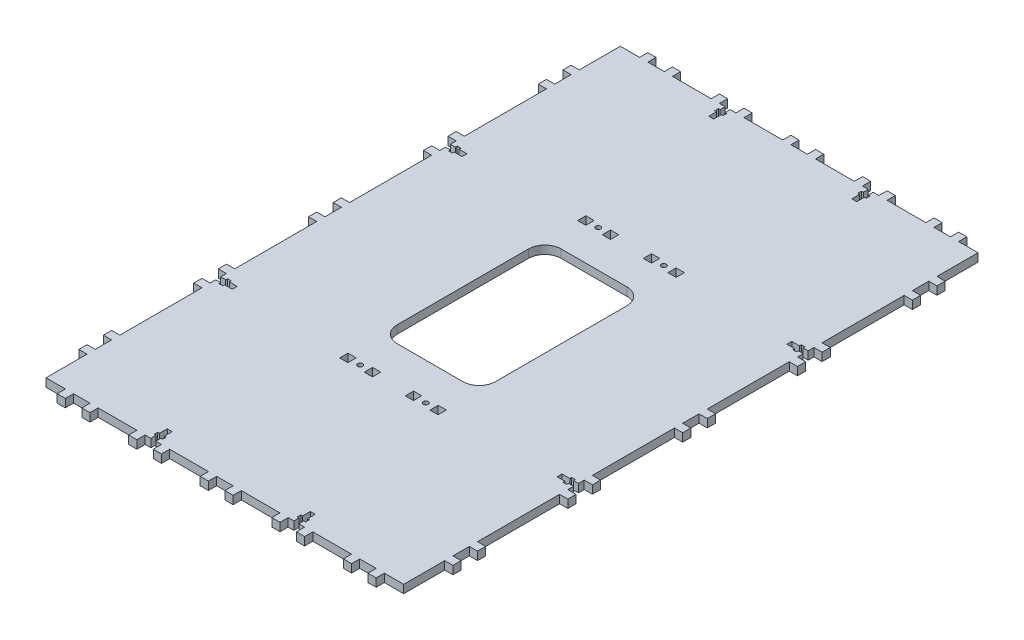
from build123d import *

# Parameters (mm, degrees)
SKETCH1_W           = 5
SKETCH1_H           = 5.05
SKETCH1_R           = 1.5
BOSS_EXTRUDE1_DEPTH = 5


with BuildPart() as part:
    # Sketch1 → Boss-Extrude1 (new body)
    with BuildSketch(Plane(origin=(0, 0, 0), x_dir=(1, 0, 0), z_dir=(0, 1, 0))):
        Polygon((97.2, -175), (109, -175), (109, -150), (114, -150), (114, -145), (109, -145), (109, -135), (114, -135), (114, -130), (109, -130), (109, -80), (114, -80), (114, -75), (109, -75), (109, -71.5), (106, -71.5), (106, -72.6), (103.7, -72.6), (103.7, -71.5), (99, -71.5), (99, -68.5), (103.7, -68.5), (103.7, -67.4), (106, -67.4), (106, -68.5), (109, -68.5), (109, -65), (114, -65), (114, -60), (109, -60), (109, -10), (114, -10), (114, -5), (109, -5), (109, 5), (114, 5), (114, 10), (109, 10), (109, 60), (114, 60), (114, 65), (109, 65), (109, 68.5), (106, 68.5), (106, 67.4), (103.7, 67.4), (103.7, 68.5), (99, 68.5), (99, 71.5), (103.7, 71.5), (103.7, 72.6), (106, 72.6), (106, 71.5), (109, 71.5), (109, 75), (114, 75), (114, 80), (109, 80), (109, 130), (114, 130), (114, 135), (109, 135), (109, 145), (114, 145), (114, 150), (109, 150), (109, 175), (97.2, 175), (97.2, 180), (92.2, 180), (92.2, 175), (82.2, 175), (82.2, 180), (77.2, 180), (77.2, 175), (53.6, 175), (53.6, 180), (48.6, 180), (48.6, 175), (45.1, 175), (45.1, 172), (46.2, 172), (46.2, 169.7), (45.1, 169.7), (45.1, 165), (42.1, 165), (42.1, 169.7), (41, 169.7), (41, 172), (42.1, 172), (42.1, 175), (38.6, 175), (38.6, 180), (33.6, 180), (33.6, 175), (19.5, 175), (10, 175), (10, 180), (5, 180), (5, 175), (-5, 175), (-5, 180), (-10, 180), (-10, 175), (-19.5, 175), (-33.6, 175), (-33.6, 180), (-38.6, 180), (-38.6, 175), (-42.1, 175), (-42.1, 172), (-41, 172), (-41, 169.7), (-42.1, 169.7), (-42.1, 165), (-45.1, 165), (-45.1, 169.7), (-46.2, 169.7), (-46.2, 172), (-45.1, 172), (-45.1, 175), (-48.6, 175), (-48.6, 180), (-53.6, 180), (-53.6, 175), (-77.2, 175), (-77.2, 180), (-82.2, 180), (-82.2, 175), (-92.2, 175), (-92.2, 180), (-97.2, 180), (-97.2, 175), (-109, 175), (-109, 150), (-114, 150), (-114, 145), (-109, 145), (-109, 135), (-114, 135), (-114, 130), (-109, 130), (-109, 80), (-114, 80), (-114, 75), (-109, 75), (-109, 71.5), (-106, 71.5), (-106, 72.6), (-103.7, 72.6), (-103.7, 71.5), (-99, 71.5), (-99, 68.5), (-103.7, 68.5), (-103.7, 67.4), (-106, 67.4), (-106, 68.5), (-109, 68.5), (-109, 65), (-114, 65), (-114, 60), (-109, 60), (-109, 10), (-114, 10), (-114, 5), (-109, 5), (-109, -5), (-114, -5), (-114, -10), (-109, -10), (-109, -60), (-114, -60), (-114, -65), (-109, -65), (-109, -68.5), (-106, -68.5), (-106, -67.4), (-103.7, -67.4), (-103.7, -68.5), (-99, -68.5), (-99, -71.5), (-103.7, -71.5), (-103.7, -72.6), (-106, -72.6), (-106, -71.5), (-109, -71.5), (-109, -75), (-114, -75), (-114, -80), (-109, -80), (-109, -130), (-114, -130), (-114, -135), (-109, -135), (-109, -145), (-114, -145), (-114, -150), (-109, -150), (-109, -175), (-97.2, -175), (-97.2, -180), (-92.2, -180), (-92.2, -175), (-82.2, -175), (-82.2, -180), (-77.2, -180), (-77.2, -175), (-53.6, -175), (-53.6, -180), (-48.6, -180), (-48.6, -175), (-45.1, -175), (-45.1, -172), (-46.2, -172), (-46.2, -169.7), (-45.1, -169.7), (-45.1, -165), (-42.1, -165), (-42.1, -169.7), (-41, -169.7), (-41, -172), (-42.1, -172), (-42.1, -175), (-38.6, -175), (-38.6, -180), (-33.6, -180), (-33.6, -175), (-19.5, -175), (-10, -175), (-10, -180), (-5, -180), (-5, -175), (5, -175), (5, -180), (10, -180), (10, -175), (19.5, -175), (33.6, -175), (33.6, -180), (38.6, -180), (38.6, -175), (42.1, -175), (42.1, -172), (41, -172), (41, -169.7), (42.1, -169.7), (42.1, -165), (45.1, -165), (45.1, -169.7), (46.2, -169.7), (46.2, -172), (45.1, -172), (45.1, -175), (48.6, -175), (48.6, -180), (53.6, -180), (53.6, -175), (77.2, -175), (77.2, -180), (82.2, -180), (82.2, -175), (92.2, -175), (92.2, -180), (97.2, -180), align=None)
        with Locations((-27.5, -72.525)):
            Rectangle(SKETCH1_W, SKETCH1_H, mode=Mode.SUBTRACT)
        with Locations(Location((-20, -72.525, 0), (0, 0, 270))):
            Circle(SKETCH1_R, mode=Mode.SUBTRACT)
        with Locations((-12.5, -72.525)):
            Rectangle(SKETCH1_W, SKETCH1_H, mode=Mode.SUBTRACT)
        with Locations((12.5, -72.525)):
            Rectangle(SKETCH1_W, SKETCH1_H, mode=Mode.SUBTRACT)
        with Locations(Location((20, -72.525, 0), (0, 0, 270))):
            Circle(SKETCH1_R, mode=Mode.SUBTRACT)
        with Locations((27.5, -72.525)):
            Rectangle(SKETCH1_W, SKETCH1_H, mode=Mode.SUBTRACT)
        with Locations((-27.5, 72.525)):
            Rectangle(SKETCH1_W, SKETCH1_H, mode=Mode.SUBTRACT)
        with Locations(Location((-20, 72.525, 0), (0, 0, 270))):
            Circle(SKETCH1_R, mode=Mode.SUBTRACT)
        with Locations((-12.5, 72.525)):
            Rectangle(SKETCH1_W, SKETCH1_H, mode=Mode.SUBTRACT)
        with BuildLine():
            ThreePointArc((-30, 40), (-27.071067812, 47.071067812), (-20, 50))
            Line((-20, 50), (20, 50))
            ThreePointArc((20, 50), (27.071067812, 47.071067812), (30, 40))
            Line((30, 40), (30, -40))
            ThreePointArc((30, -40), (27.071067812, -47.071067812), (20, -50))
            Line((20, -50), (-20, -50))
            ThreePointArc((-20, -50), (-27.071067812, -47.071067812), (-30, -40))
            Line((-30, -40), (-30, 40))
        make_face(mode=Mode.SUBTRACT)
        with Locations((12.5, 72.525)):
            Rectangle(SKETCH1_W, SKETCH1_H, mode=Mode.SUBTRACT)
        with Locations(Location((20, 72.525, 0), (0, 0, 270))):
            Circle(SKETCH1_R, mode=Mode.SUBTRACT)
        with Locations((27.5, 72.525)):
            Rectangle(SKETCH1_W, SKETCH1_H, mode=Mode.SUBTRACT)
    extrude(amount=BOSS_EXTRUDE1_DEPTH)


solid = part.part
